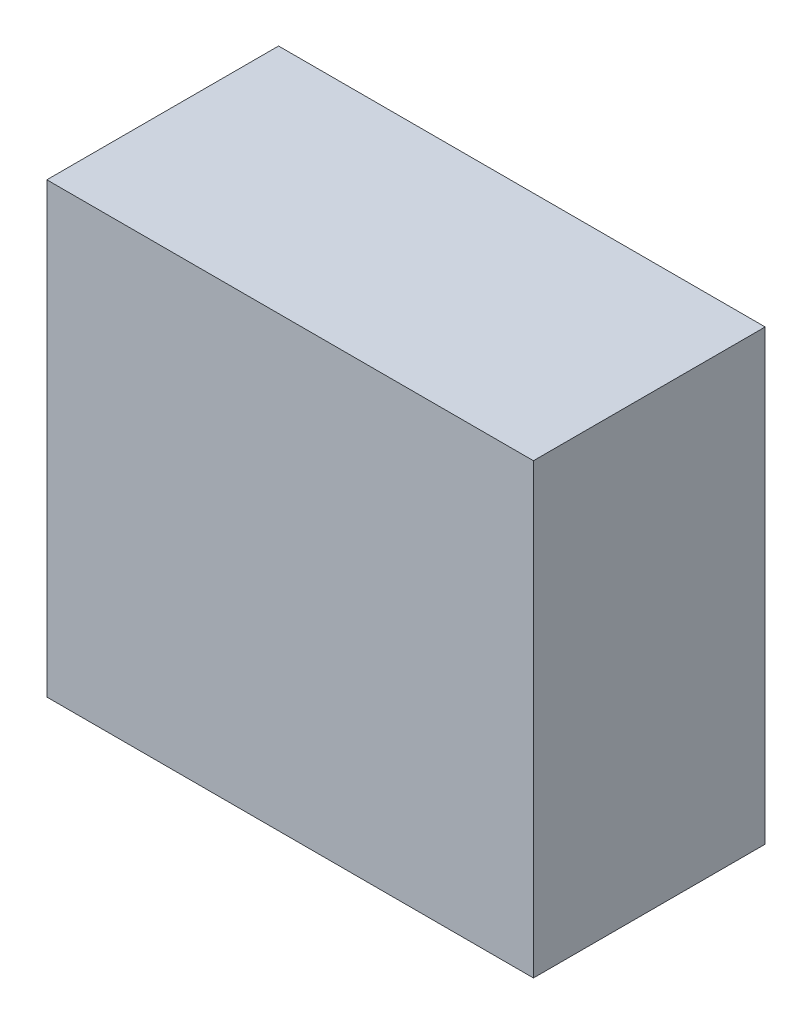
from build123d import *

# Parameters (mm, degrees)
SKETCH1_W           = 63
SKETCH1_H           = 58
BOSS_EXTRUDE1_DEPTH = 30


with BuildPart() as part:
    # Sketch1 → Boss-Extrude1 (new body)
    with BuildSketch(Plane.XY):
        Rectangle(SKETCH1_W, SKETCH1_H)
    extrude(amount=BOSS_EXTRUDE1_DEPTH)


solid = part.part
